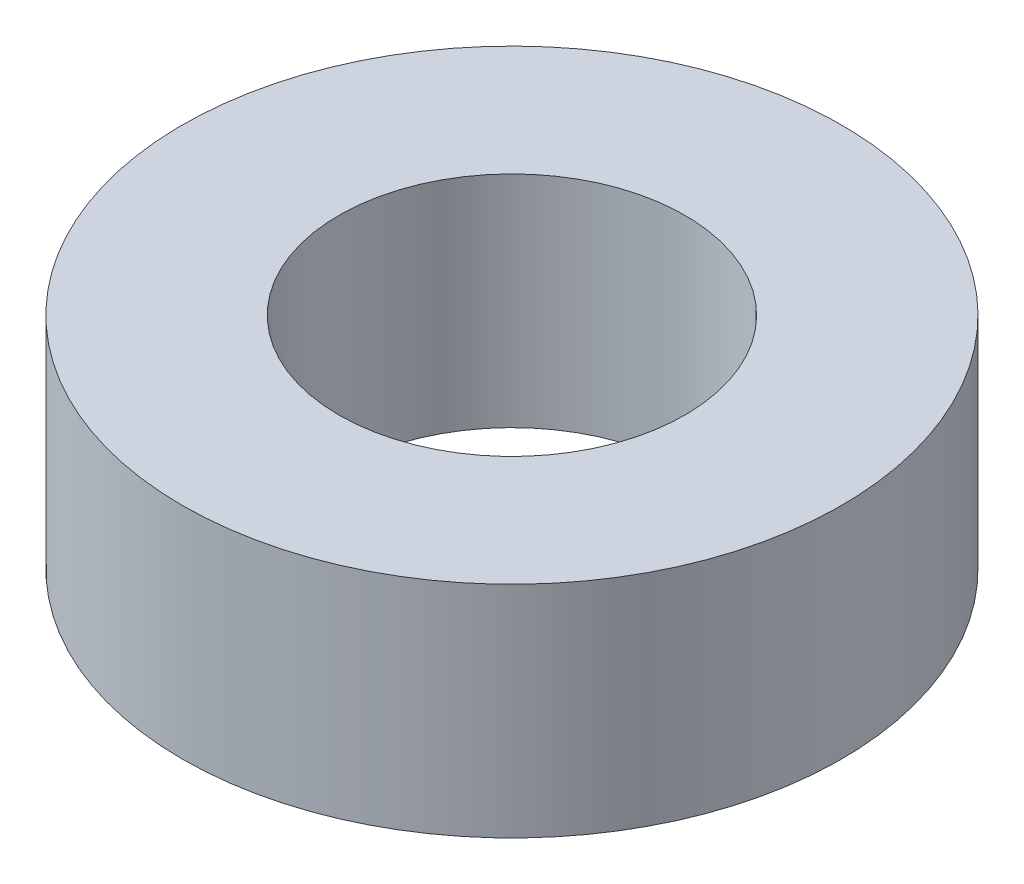
from build123d import *

# Parameters (mm, degrees)
SKETCH_1_R      = 6
SKETCH_1_R_2    = 3.15
EXTRUDE_1_DEPTH = 4


with BuildPart() as part:
    # 草图1 → 凸台-拉伸1 (new body)
    with BuildSketch(Plane(origin=(0, 0, 0), x_dir=(1, 0, 0), z_dir=(0, 1, 0))):
        with Locations(Location((0, 0, 0), (0, 0, 270))):
            Circle(SKETCH_1_R)
        with Locations(Location((0, 0, 0), (0, 0, 270))):
            Circle(SKETCH_1_R_2, mode=Mode.SUBTRACT)
    extrude(amount=EXTRUDE_1_DEPTH)


solid = part.part
